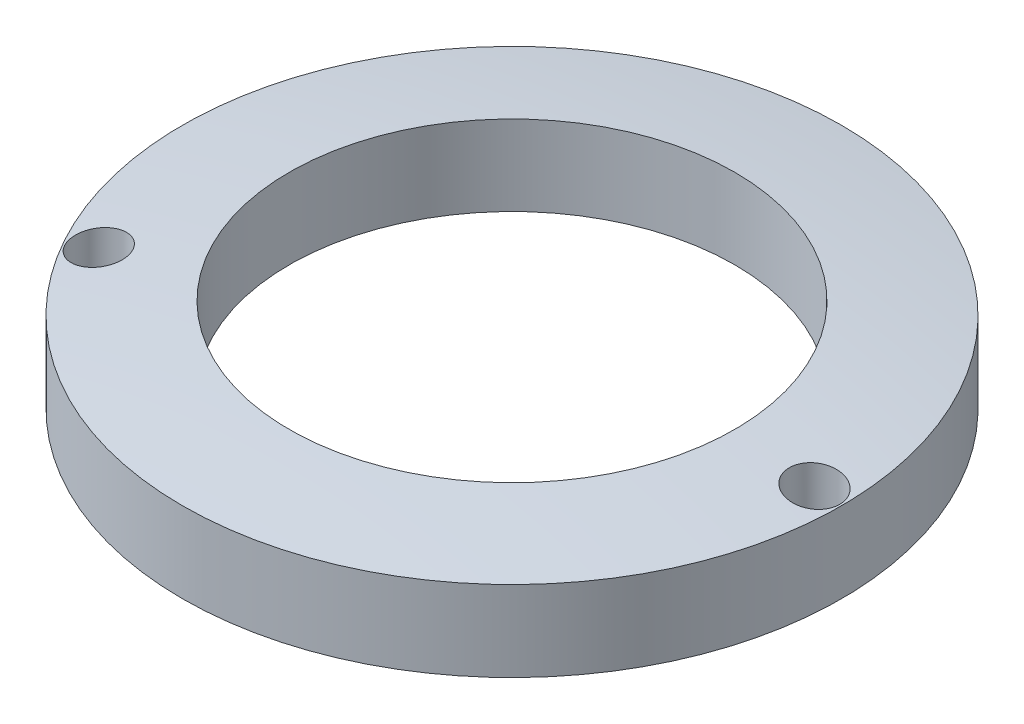
from build123d import *

# Parameters (mm, degrees)
SKETCH2_R          = 3
CUT_EXTRUDE3_DEPTH = 284.956285877


with BuildPart() as part:
    # Sketch1 → Revolve1 (revolve)
    with BuildSketch(Plane.XY):
        with BuildLine():
            Line((26.51, 277.486544539), (26.51, 268.946616264))
            ThreePointArc((26.51, 268.946616264), (32.874227001, 268.243075771), (39.22, 267.388956578))
            Line((39.22, 267.388956578), (39.22, 275.97708981))
            Line((39.22, 275.97708981), (39.22, 276.97708981))
            ThreePointArc((39.22, 276.97708981), (32.873664815, 277.804777165), (26.51, 278.486544539))
            Line((26.51, 278.486544539), (26.51, 277.486544539))
        make_face()
    revolve(axis=Axis((0, 0, 0), (0, 1, 0)))

    # Sketch2 → Cut-Extrude3 (cut, through all)
    with BuildSketch(Plane(origin=(0, 0, 0), x_dir=(1, 0, 0), z_dir=(0, 1, 0))):
        with Locations(Location((-31.176914536, -18, 0), (0, 0, 133.911115667))):
            Circle(SKETCH2_R)
        with Locations(Location((36, 0, 0), (0, 0, 135.098113779))):
            Circle(SKETCH2_R)
    extrude(amount=CUT_EXTRUDE3_DEPTH, mode=Mode.SUBTRACT)


solid = part.part
